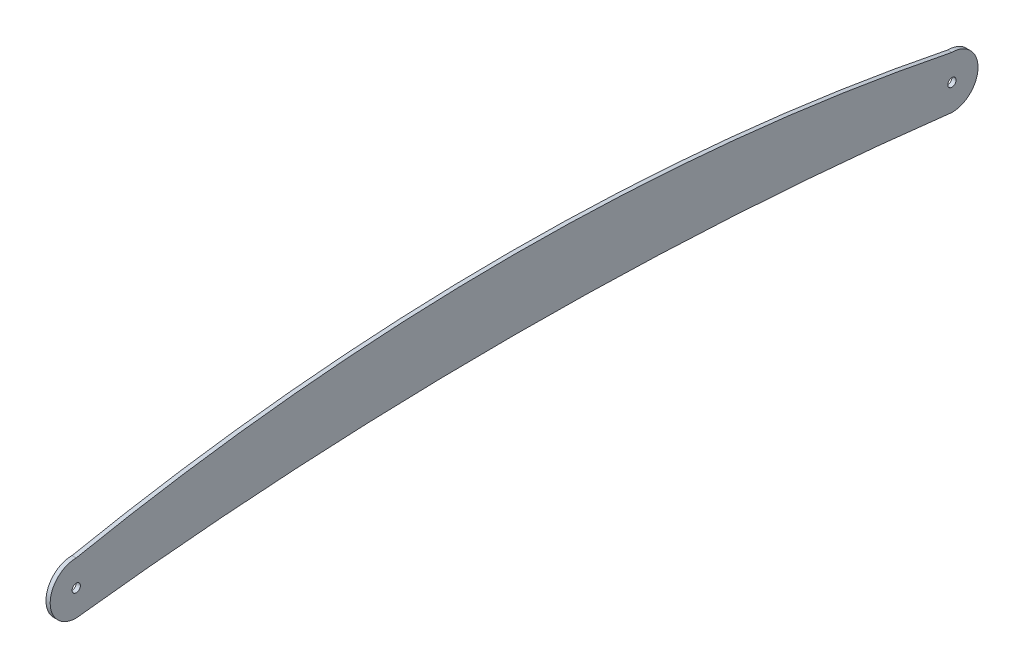
from build123d import *

# Parameters (mm, degrees)
SKETCH1_R           = 2.54
BOSS_EXTRUDE1_DEPTH = 2.54


with BuildPart() as part:
    # Sketch1 → Boss-Extrude1 (new body)
    # profile 1 of 3: a face of its own
    with BuildSketch(Plane(origin=(0, 0, 0), x_dir=(0, 0, -1), z_dir=(1, 0, 0))):
        with BuildLine():
            ThreePointArc((-263.315482234, 15.875), (-252.090162082, 11.225320151), (-247.440482234, 0))
            ThreePointArc((-247.440482234, 0), (-250.845779802, -9.824568503), (-259.600752631, -15.434260882))
            ThreePointArc((-259.600752631, -15.434260882), (3.384517766, 0.002547972), (266.369788164, -15.434260882))
            ThreePointArc((266.369788164, -15.434260882), (254.320087607, 1.870392137), (270.084517766, 15.875))
            ThreePointArc((270.084517766, 15.875), (3.384517766, 42.576584001), (-263.315482234, 15.875))
        make_face()
    # profile 2 of 3: a face of its own
    with BuildSketch(Plane(origin=(0, 0, 0), x_dir=(0, 0, -1), z_dir=(1, 0, 0))):
        with BuildLine():
            ThreePointArc((-259.600752631, -15.434260882), (-250.845779802, -9.824568503), (-247.440482234, 0))
            ThreePointArc((-247.440482234, 0), (-252.090162082, 11.225320151), (-263.315482234, 15.875))
            ThreePointArc((-263.315482234, 15.875), (-279.190482234, 0), (-263.315482234, -15.875))
            ThreePointArc((-263.315482234, -15.875), (-261.458209114, -15.653857706), (-259.600752631, -15.434260882))
        make_face()
        with Locations((-263.315482234, 0)):
            Circle(SKETCH1_R, mode=Mode.SUBTRACT)
    # profile 3 of 3: a face of its own
    with BuildSketch(Plane(origin=(0, 0, 0), x_dir=(0, 0, -1), z_dir=(1, 0, 0))):
        with BuildLine():
            ThreePointArc((285.959517766, 0), (281.309837918, 11.225320151), (270.084517766, 15.875))
            ThreePointArc((270.084517766, 15.875), (254.320087607, 1.870392137), (266.369788164, -15.434260882))
            ThreePointArc((266.369788164, -15.434260882), (268.227244647, -15.653857706), (270.084517766, -15.875))
            ThreePointArc((270.084517766, -15.875), (281.309837918, -11.225320151), (285.959517766, 0))
        make_face()
        with Locations((270.084517766, 0)):
            Circle(SKETCH1_R, mode=Mode.SUBTRACT)
    extrude(amount=BOSS_EXTRUDE1_DEPTH)


solid = part.part
